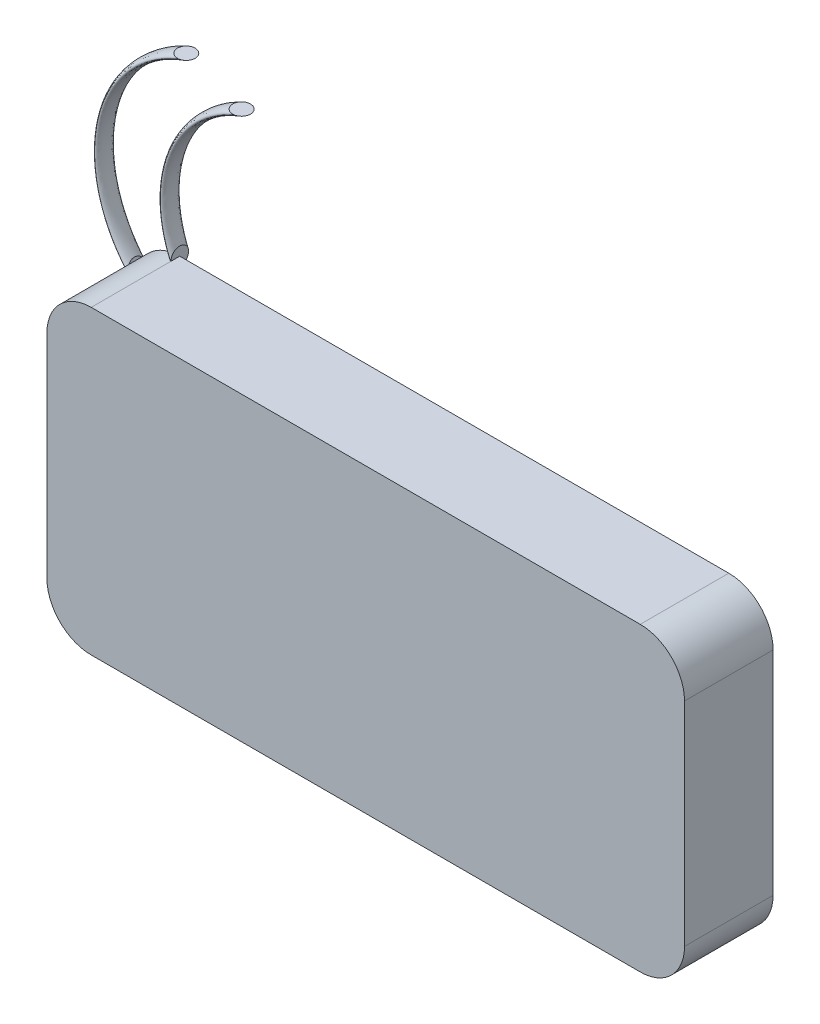
from build123d import *

# Parameters (mm, degrees)
SALIENTE_EXTRUIR1_DEPTH = 10
CROQUIS4_R              = 1
CROQUIS7_R              = 0.999100302


with BuildPart() as part:
    # Croquis1 → Saliente-Extruir1 (new body)
    with BuildSketch(Plane.XY):
        with BuildLine():
            Line((5, 0), (67, 0))
            ThreePointArc((67, 0), (70.535533906, 1.464466094), (72, 5))
            Line((72, 5), (72, 29))
            ThreePointArc((72, 29), (70.535533906, 32.535533906), (67, 34))
            Line((67, 34), (5, 34))
            ThreePointArc((5, 34), (1.464466094, 32.535533906), (0, 29))
            Line((0, 29), (0, 5))
            ThreePointArc((0, 5), (1.464466094, 1.464466094), (5, 0))
        make_face()
    extrude(amount=SALIENTE_EXTRUIR1_DEPTH)

    # Barrer1: sweep along a path in Croquis3
    with BuildLine(Plane(origin=(0, 0, 0), x_dir=(-1, 0, 0), z_dir=(0, 0, -1))) as barrer1_path:
        ThreePointArc((-0.205298063, 30.418038551), (3.171388104, 43.747173205), (-5.740387444, 54.218471915))
    # Croquis4 → Barrer1 (sweep)
    with BuildSketch(Plane(origin=(0, 54.218471915, 0), x_dir=(1, 0, 0), z_dir=(0, 1, 0))):
        with Locations((5.735070399, 0)):
            Circle(CROQUIS4_R)
    sweep(path=barrer1_path.line)

    # Barrer4: sweep along a path in Croquis6
    with BuildLine(Plane(origin=(0, 0, 0), x_dir=(-1, 0, 0), z_dir=(0, 0, -1))) as barrer4_path:
        ThreePointArc((-5, 34), (-4.788739539, 44.389346101), (-11.985732915, 51.885106885))
    # Croquis7 → Barrer4 (sweep)
    with BuildSketch(Plane(origin=(0, 51.885106885, 0), x_dir=(1, 0, 0), z_dir=(0, 1, 0))):
        with Locations((11.985732915, 0)):
            Circle(CROQUIS7_R)
    sweep(path=barrer4_path.line)


solid = part.part
